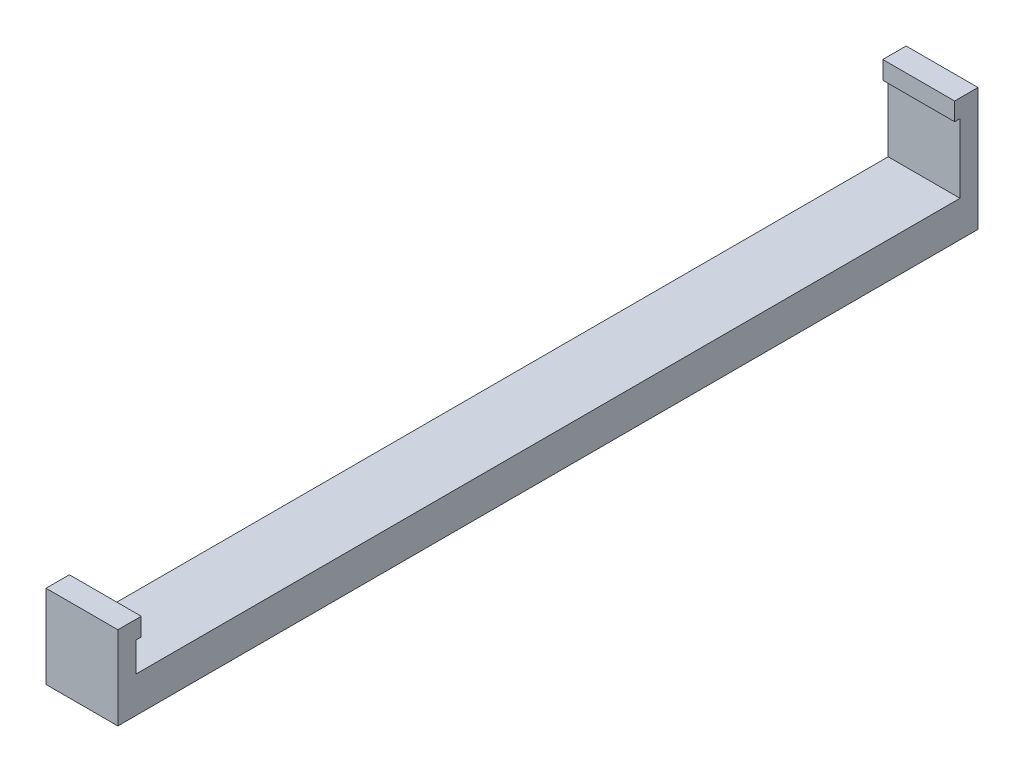
from build123d import *

# Parameters (mm, degrees)
SKETCH1_W           = 10
SKETCH1_H           = 114.68
BOSS_EXTRUDE1_DEPTH = 5
BOSS_EXTRUDE2_DEPTH = 10


with BuildPart() as part:
    # Sketch1 → Boss-Extrude1 (new body)
    with BuildSketch(Plane(origin=(0, 0, 0), x_dir=(1, 0, 0), z_dir=(0, 1, 0))):
        with Locations((5, 57.34)):
            Rectangle(SKETCH1_W, SKETCH1_H)
    extrude(amount=BOSS_EXTRUDE1_DEPTH)

    # Sketch3 → Boss-Extrude2 (add, through all)
    with BuildSketch(Plane(origin=(10, 0, 0), x_dir=(0, 0, -1), z_dir=(1, 0, 0))):
        Polygon((0.75, 9.1), (0, 9.1), (0, 0), (-2.5, 0), (-2.5, 9.1), (-2.5, 11.6), (0.75, 11.6), align=None)
        Polygon((114.68, 0), (117.18, 0), (117.18, 14.6), (117.18, 17.1), (113.93, 17.1), (113.93, 14.6), (114.68, 14.6), align=None)
    extrude(amount=-BOSS_EXTRUDE2_DEPTH)


solid = part.part
